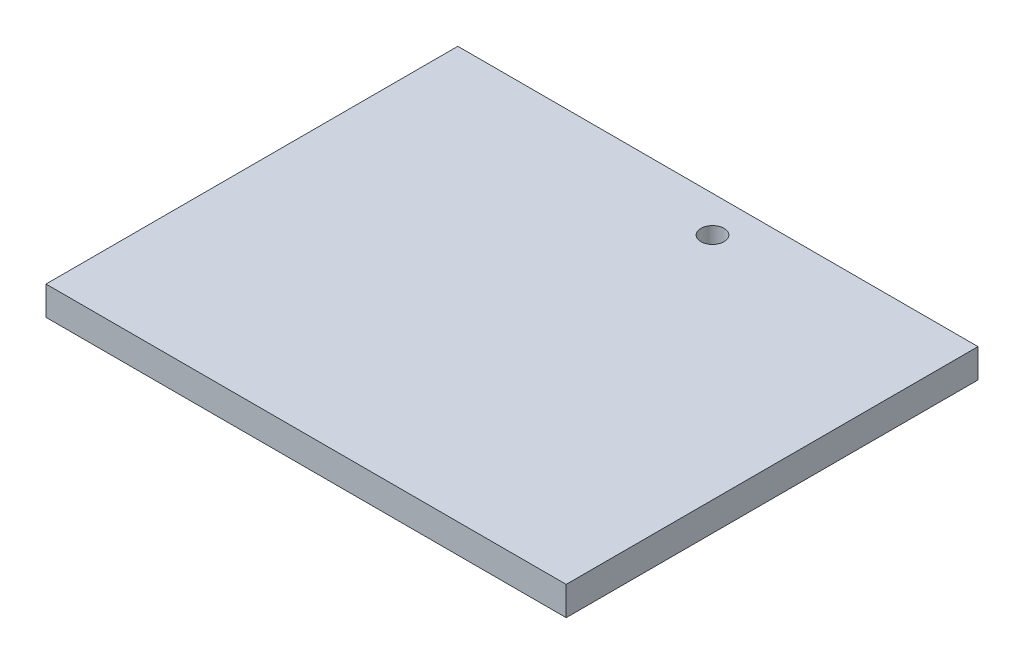
from build123d import *

# Parameters (mm, degrees)
SKETCH1_R           = 1.6
BOSS_EXTRUDE1_DEPTH = 4


with BuildPart() as part:
    # Sketch1 → Boss-Extrude1 (new body)
    with BuildSketch(Plane(origin=(0, 0, 0), x_dir=(1, 0, 0), z_dir=(0, 1, 0))):
        Polygon((36, -28.5), (36, 28.5), (4.25, 28.5), (-36, 28.5), (-36, -28.5), align=None)
        with Locations(Location((4.25, 23.5, 0), (0, 0, 270))):
            Circle(SKETCH1_R, mode=Mode.SUBTRACT)
    extrude(amount=BOSS_EXTRUDE1_DEPTH)


solid = part.part
